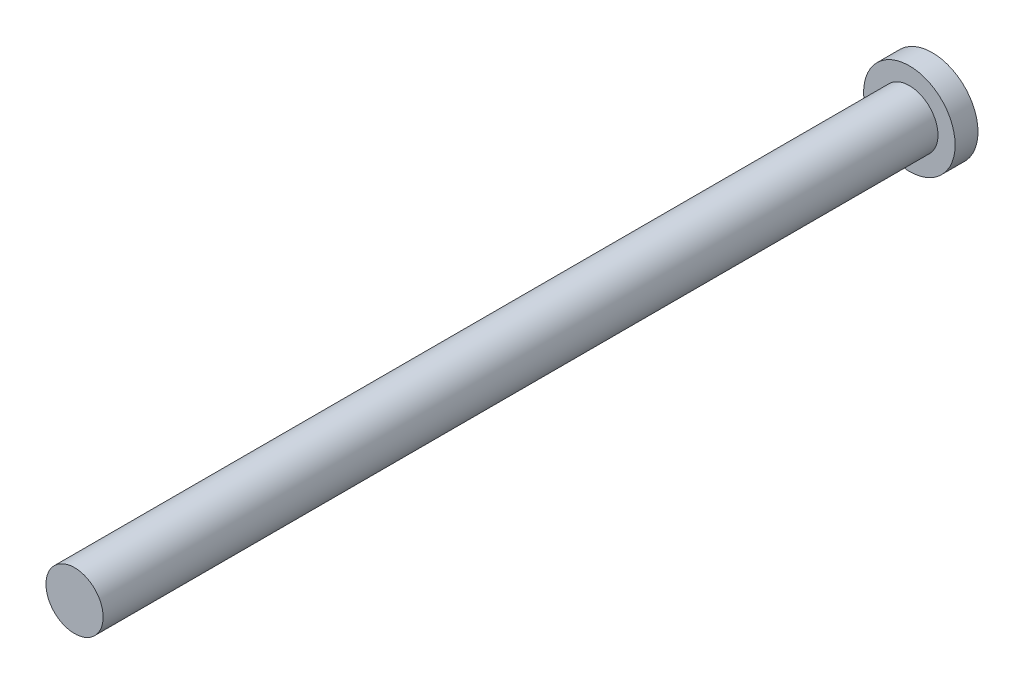
from build123d import *

# Parameters (mm, degrees)
ESQUISSE1_R        = 2.5
BOSS_EXTRU_1_DEPTH = 75
ESQUISSE1_3_R      = 4
ESQUISSE1_3_R_2    = 2.5
BOSS_EXTRU_2_DEPTH = 2


with BuildPart() as part:
    # Esquisse1 → Boss.-Extru.1 (new body)
    with BuildSketch(Plane.XY):
        Circle(ESQUISSE1_R)
    extrude(amount=BOSS_EXTRU_1_DEPTH)

    # Esquisse1<3> → Boss.-Extru.2 (add)
    with BuildSketch(Plane.XY):
        Circle(ESQUISSE1_3_R)
        Circle(ESQUISSE1_3_R_2, mode=Mode.SUBTRACT)
    extrude(amount=BOSS_EXTRU_2_DEPTH)


solid = part.part
